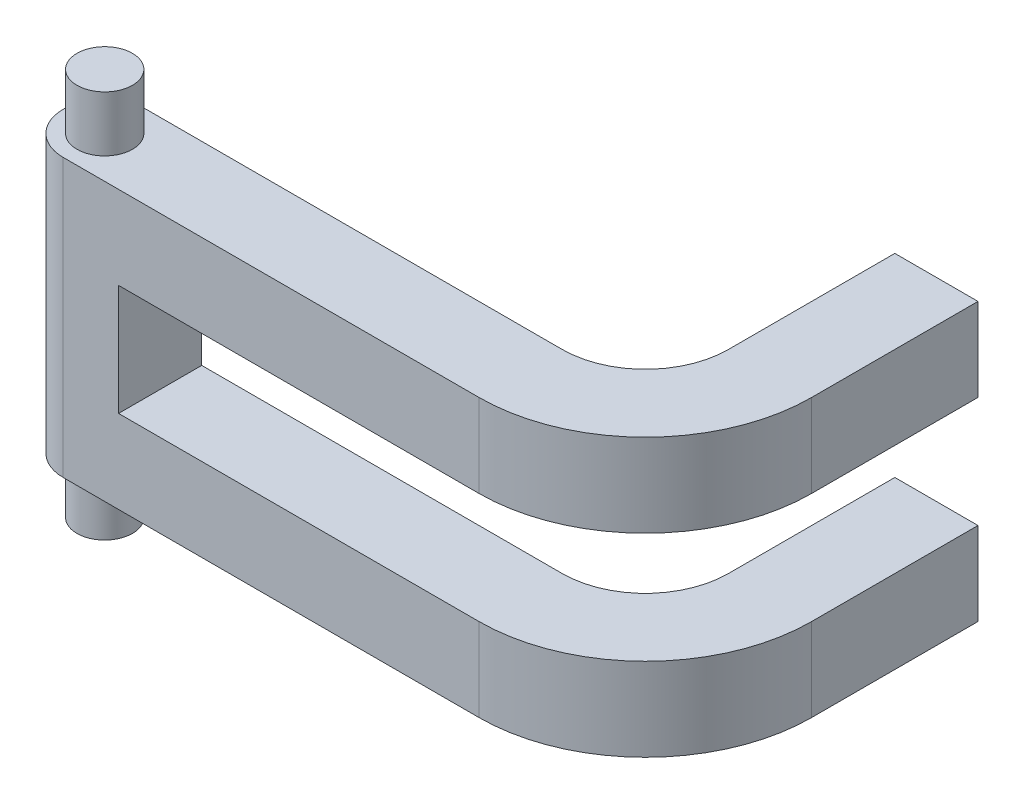
from build123d import *

# Parameters (mm, degrees)
EXTRUDE_1_DEPTH      = 42.498268572
EXTRUDE_1_DEPTH_BACK = 7.5
SKETCH_1_R           = 5
SKETCH_2_R           = 5
EXTRUDE_2_DEPTH      = 17.5
SKETCH_3_R           = 5
EXTRUDE_3_DEPTH      = 52.5
SKETCH_4_W           = 107.730205786
SKETCH_4_H           = 74.358975683
CUT_EXTRUDE_1_DEPTH  = 10


with BuildPart() as part:
    # 草图1 → 凸台-拉伸1 (new, two sides: drawn at the far end of the back side and taken through both)
    with BuildSketch(Plane(origin=(0, 0, 0), x_dir=(1, 0, 0), z_dir=(0, 1, 0)).offset(-EXTRUDE_1_DEPTH_BACK)):
        with BuildLine():
            Line((0, 0), (75, 0))
            ThreePointArc((75, 0), (96.213203436, 8.786796564), (105, 30))
            Line((105, 30), (105, 60))
            Line((105, 60), (90, 60))
            Line((90, 60), (90, 30))
            ThreePointArc((90, 30), (85.606601718, 19.393398282), (75, 15))
            Line((75, 15), (0, 15))
            ThreePointArc((0, 15), (-7.5, 7.5), (0, 0))
        make_face()
        with Locations(Location((0, 7.5, 0), (0, 0, 270))):
            Circle(SKETCH_1_R, mode=Mode.SUBTRACT)
    extrude(amount=EXTRUDE_1_DEPTH + EXTRUDE_1_DEPTH_BACK)

    # 草图2 → 凸台-拉伸2 (add, symmetric)
    with BuildSketch(Plane(origin=(0, 0, 0), x_dir=(1, 0, 0), z_dir=(0, 1, 0))):
        with Locations(Location((0, 7.5, 0), (0, 0, 270))):
            Circle(SKETCH_2_R)
    extrude(amount=EXTRUDE_2_DEPTH, both=True)

    # 草图3 → 凸台-拉伸3 (add)
    with BuildSketch(Plane(origin=(0, 0, 0), x_dir=(1, 0, 0), z_dir=(0, 1, 0))):
        with Locations(Location((0, 7.5, 0), (0, 0, 270))):
            Circle(SKETCH_3_R)
    extrude(amount=EXTRUDE_3_DEPTH)

    # 草图4 → 切除-拉伸1 (cut, symmetric)
    with BuildSketch(Plane(origin=(0, 17.5, 0), x_dir=(1, 0, 0), z_dir=(0, 1, 0))):
        with Locations((63.865102893, 35.82913053)):
            Rectangle(SKETCH_4_W, SKETCH_4_H)
    extrude(amount=CUT_EXTRUDE_1_DEPTH, both=True, mode=Mode.SUBTRACT)


solid = part.part
